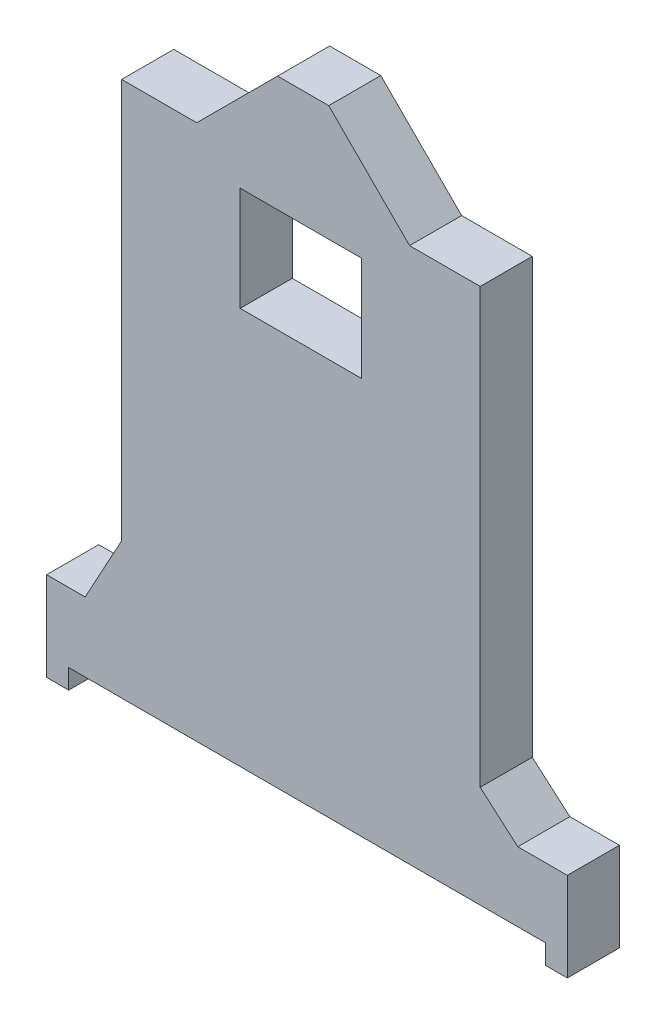
from build123d import *

# Parameters (mm, degrees)
SKETCH1_W           = 177.8
SKETCH1_H           = 152.4
BOSS_EXTRUDE1_DEPTH = 76.2


with BuildPart() as part:
    # Sketch1 → Boss-Extrude1 (new body)
    with BuildSketch(Plane.XY):
        Polygon((0, 0), (32.300024104, 0), (32.300024104, 28.626330926), (729.742, 28.626330926), (729.742, 0), (762, 0), (762, 130.141188099), (689.530233431, 130.141188099), (634.518291525, 177.963119361), (634.518291525, 812.8), (531.162645999, 812.8), (412.853551647, 931.109094352), (337.940659012, 931.109094352), (219.631564661, 812.8), (109.846491066, 812.8), (109.846491066, 228.180400099), (56.370557248, 130.141188099), (0, 130.141188099), align=None)
        with Locations((372.182391296, 685.531245819)):
            Rectangle(SKETCH1_W, SKETCH1_H, mode=Mode.SUBTRACT)
    extrude(amount=BOSS_EXTRUDE1_DEPTH)


solid = part.part
